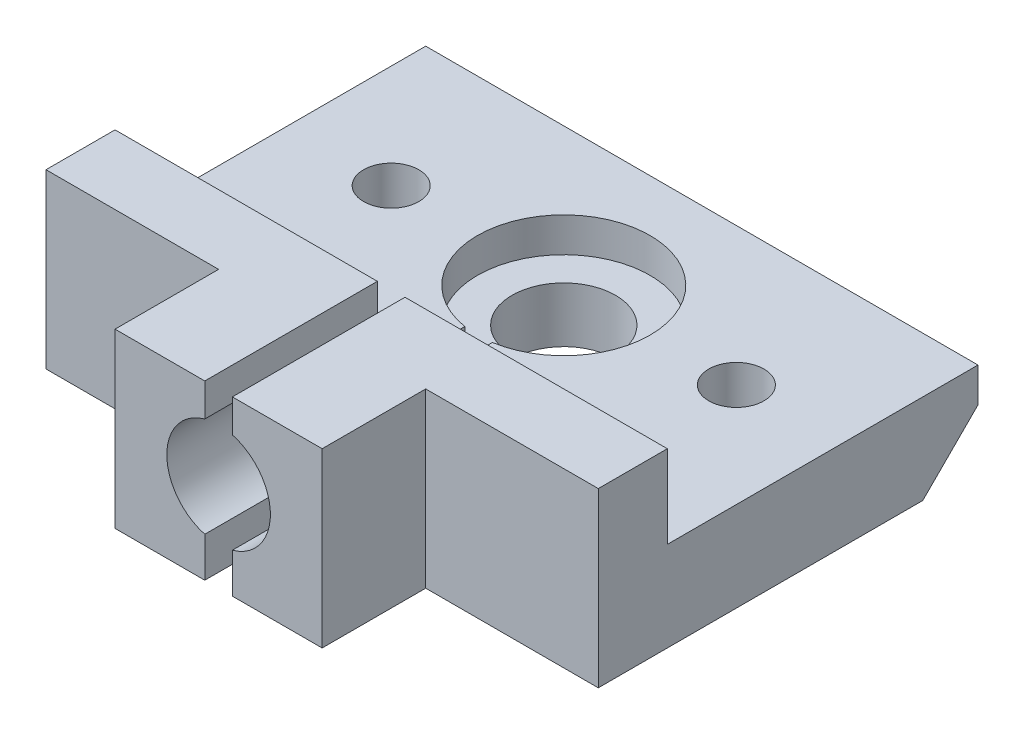
from build123d import *

# Parameters (mm, degrees)
BOSS_EXTRUDE1_DEPTH     = 25
CUT_EXTRUDE2_DEPTH      = 110.201648339
CUT_EXTRUDE2_DEPTH_BACK = 110.201648339
SKETCH2_W               = 45
SKETCH2_H               = 12
CHAMFER1_SIZE           = 8
SKETCH3_R               = 7.5
SKETCH3_R_2             = 4
CUT_EXTRUDE3_DEPTH      = 25
SKETCH4_R               = 12.5
CUT_EXTRUDE4_DEPTH      = 5
SKETCH5_W               = 4
SKETCH5_H               = 52.762109512
CUT_EXTRUDE5_DEPTH      = 110.201648339
SKETCH6_R               = 7.5
CUT_EXTRUDE6_DEPTH      = 15


with BuildPart() as part:
    # Sketch1 → Boss-Extrude1 (new body)
    with BuildSketch(Plane(origin=(0, 0, 0), x_dir=(1, 0, 0), z_dir=(0, 1, 0))):
        Polygon((25, 0), (55, 0), (55, 15), (80, 15), (80, 70), (0, 70), (0, 15), (25, 15), align=None)
    extrude(amount=BOSS_EXTRUDE1_DEPTH)

    # Sketch2 → Cut-Extrude2 (cut, two sides: drawn at the far end of the back side and taken through both)
    with BuildSketch(Plane(origin=(0, 0, 0), x_dir=(0, 0, -1), z_dir=(1, 0, 0)).offset(-CUT_EXTRUDE2_DEPTH_BACK)):
        with Locations((47.5, 19)):
            Rectangle(SKETCH2_W, SKETCH2_H)
    extrude(amount=CUT_EXTRUDE2_DEPTH + CUT_EXTRUDE2_DEPTH_BACK, mode=Mode.SUBTRACT)

    # Chamfer1
    chamfer1_edges = [part.edges().sort_by_distance(p)[0] for p in [
        (40, 0, -70),
    ]]
    chamfer(chamfer1_edges, length=CHAMFER1_SIZE)

    # Sketch3 → Cut-Extrude3 (cut)
    with BuildSketch(Plane(origin=(0, 13, 0), x_dir=(1, 0, 0), z_dir=(0, 1, 0))):
        with Locations(Location((40, 50, 0), (0, 0, 270))):
            Circle(SKETCH3_R)
        with Locations(Location((65, 50, 0), (0, 0, 270))):
            Circle(SKETCH3_R_2)
        with Locations(Location((15, 50, 0), (0, 0, 270))):
            Circle(SKETCH3_R_2)
    extrude(amount=-CUT_EXTRUDE3_DEPTH, mode=Mode.SUBTRACT)

    # Sketch4 → Cut-Extrude4 (cut)
    with BuildSketch(Plane(origin=(0, 13, 0), x_dir=(1, 0, 0), z_dir=(0, 1, 0))):
        with Locations(Location((40, 50, 0), (0, 0, 270))):
            Circle(SKETCH4_R)
    extrude(amount=-CUT_EXTRUDE4_DEPTH, mode=Mode.SUBTRACT)

    # Sketch5 → Cut-Extrude5 (cut, through all)
    with BuildSketch(Plane(origin=(0, 25, 0), x_dir=(1, 0, 0), z_dir=(0, 1, 0))):
        with Locations((40, 25.178276377)):
            Rectangle(SKETCH5_W, SKETCH5_H)
    extrude(amount=-CUT_EXTRUDE5_DEPTH, mode=Mode.SUBTRACT)

    # Sketch6 → Cut-Extrude6 (cut)
    with BuildSketch(Plane.XY):
        with Locations((40, 13)):
            Circle(SKETCH6_R)
    extrude(amount=-CUT_EXTRUDE6_DEPTH, mode=Mode.SUBTRACT)


solid = part.part
